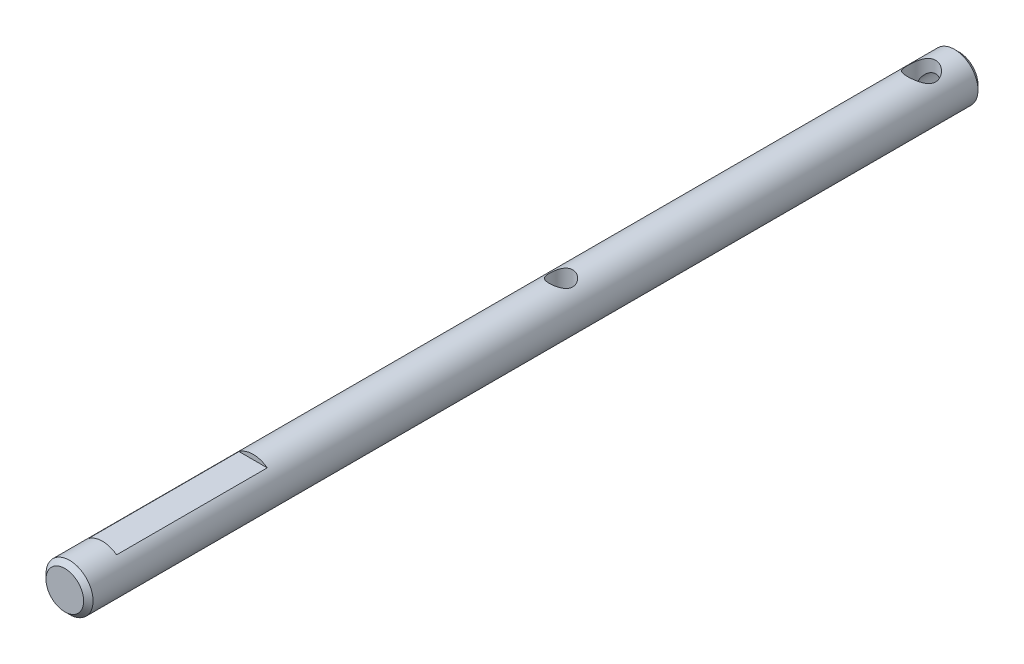
from build123d import *

# Parameters (mm, degrees)
SKETCH1_R                  = 2.5
BOSS_EXTRUDE1_DEPTH        = 95
CUT_EXTRUDE1_DEPTH         = 96.065766709
CUT_EXTRUDE1_DEPTH_BACK    = 96.065766709
SKETCH2_R                  = 1.5
CHAMFER1_SIZE              = 0.5
M3X0_5_TAPPED_HOLE1_REACH  = 97.066
M3X0_5_TAPPED_HOLE1_BORE_R = 1.25
CUT_EXTRUDE2_DEPTH         = 96.065766714
CUT_EXTRUDE2_DEPTH_BACK    = 96.065766714
SKETCH6_W                  = 16
SKETCH6_H                  = 0.5
M3X0_5_TAPPED_HOLE2_D      = 2.5


with BuildPart() as part:
    # Sketch1 → Boss-Extrude1 (new body)
    with BuildSketch(Plane.XY):
        Circle(SKETCH1_R)
    extrude(amount=BOSS_EXTRUDE1_DEPTH)

    # Sketch2 → Cut-Extrude1 (cut, two sides: drawn at the far end of the back side and taken through both)
    with BuildSketch(Plane(origin=(0, 0, 0), x_dir=(1, 0, 0), z_dir=(0, 1, 0)).offset(-CUT_EXTRUDE1_DEPTH_BACK)):
        with Locations(Location((0, -4, 0), (0, 0, 270))):
            Circle(SKETCH2_R)
    extrude(amount=CUT_EXTRUDE1_DEPTH + CUT_EXTRUDE1_DEPTH_BACK, mode=Mode.SUBTRACT)

    # Chamfer1
    chamfer1_edges = [part.edges().sort_by_distance(p)[0] for p in [
        (-2.5, 0, 0),
        (-2.5, 0, 95),
    ]]
    chamfer(chamfer1_edges, length=CHAMFER1_SIZE)

    # M3x0.5 Tapped Hole1 bore → M3x0.5 Tapped Hole1 (cut, up to next)
    with BuildSketch(Plane(origin=(0, 0, 0), x_dir=(-1, 0, 0), z_dir=(0, 0, -1)), mode=Mode.PRIVATE) as m3x0_5_tapped_hole1_sk1:
        Circle(M3X0_5_TAPPED_HOLE1_BORE_R)
    m3x0_5_tapped_hole1_tool1 = extrude(m3x0_5_tapped_hole1_sk1.sketch, amount=-M3X0_5_TAPPED_HOLE1_REACH, mode=Mode.PRIVATE) & part.part
    add(m3x0_5_tapped_hole1_tool1.solids().sort_by_distance((0, 0, 0))[0], mode=Mode.SUBTRACT)

    # Sketch6 → Cut-Extrude2 (cut, two sides: drawn at the far end of the back side and taken through both)
    with BuildSketch(Plane(origin=(0, 0, 0), x_dir=(0, 0, -1), z_dir=(1, 0, 0)).offset(-CUT_EXTRUDE2_DEPTH_BACK)):
        with Locations((-83, 2.25)):
            Rectangle(SKETCH6_W, SKETCH6_H)
    extrude(amount=CUT_EXTRUDE2_DEPTH + CUT_EXTRUDE2_DEPTH_BACK, mode=Mode.SUBTRACT)

    # M3x0.5 Tapped Hole2 (through all)
    with Locations(Plane(origin=(0, 3, 0), x_dir=(1, 0, 0), z_dir=(0, 1, 0))):
        with Locations((0, -42.3)):
            Hole(M3X0_5_TAPPED_HOLE2_D / 2)


solid = part.part
